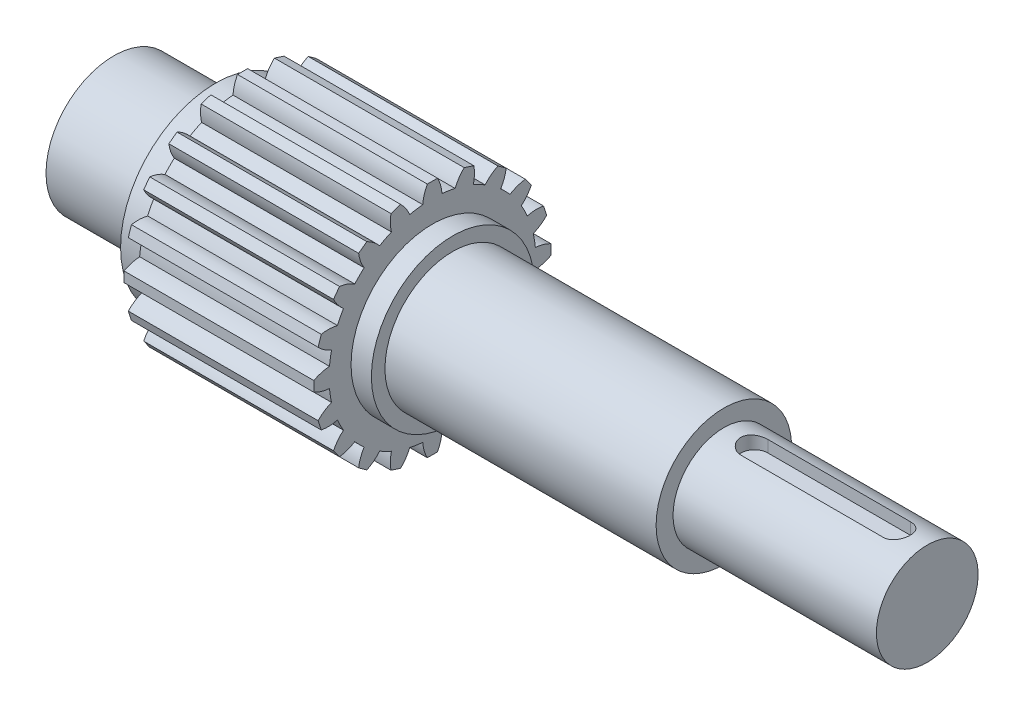
from build123d import *

# Parameters (mm, degrees)
CUT_EXTRUDE_1_DEPTH      = 4
SKETCH_3_W               = 56
SKETCH_3_H               = 6.5
EXTRUDE_1_DEPTH          = 56
PATTERN_CIRCULAR_1_COUNT = 20


with BuildPart() as part:
    # 草图1 → 旋转2 (revolve)
    with BuildSketch(Plane.XY, mode=Mode.PRIVATE) as revolve_2_sk:
        Polygon((-56.927945362, 0), (183.072054638, 0), (183.072054638, 15), (123.072054638, 15), (123.072054638, 20), (43.072054638, 20), (43.072054638, 24), (-18.927945362, 24), (-18.927945362, 28), (-26.927945362, 28), (-26.927945362, 20), (-56.927945362, 20), align=None)
    revolve(revolve_2_sk.sketch.rotate(Axis((-87.906104207, 0, 0), (1, 0, 0)), 90), axis=Axis((-87.906104207, 0, 0), (1, 0, 0)))

    # 草图2 → 切除-拉伸1 (cut)
    with BuildSketch(Plane(origin=(0, 15, 0), x_dir=(-1, 0, 0), z_dir=(0, 1, 0))):
        with BuildLine():
            Line((-174.072054638, -4), (-132.072054638, -4))
            ThreePointArc((-132.072054638, -4), (-128.072054638, 0), (-132.072054638, 4))
            Line((-132.072054638, 4), (-174.072054638, 4))
            ThreePointArc((-174.072054638, 4), (-178.072054638, 0), (-174.072054638, -4))
        make_face()
    extrude(amount=-CUT_EXTRUDE_1_DEPTH, mode=Mode.SUBTRACT)

    # 草图3 → 旋转4 (revolve)
    with BuildSketch(Plane.XY, mode=Mode.PRIVATE) as revolve_4_sk:
        with Locations((9.072054638, 27.25)):
            Rectangle(SKETCH_3_W, SKETCH_3_H)
    revolve(revolve_4_sk.sketch.rotate(Axis((-56.927945362, 0, 0), (1, 0, 0)), 90), axis=Axis((-56.927945362, 0, 0), (1, 0, 0)))

    # 草图5 → 凸台-拉伸1 (add)
    with BuildSketch(Plane(origin=(37.072054638, 0, 0), x_dir=(0, 0, -1), z_dir=(1, 0, 0))):
        with BuildLine():
            Line((-2.63562284, 27.368933751), (2.63562284, 27.368933751))
            ThreePointArc((2.63562284, 27.368933751), (2.733180603, 31.267824503), (1.5, 34.96784237))
            Line((1.5, 34.96784237), (-1.5, 34.96784237))
            ThreePointArc((-1.5, 34.96784237), (-2.733180603, 31.267824503), (-2.63562284, 27.368933751))
        make_face()
    extrude_1 = extrude(amount=-EXTRUDE_1_DEPTH)

    # 阵列(圆周)1: 凸台-拉伸1 ×20 about axis
    pattern_circular_1_axis = Axis((0, 0, 0), (1, 0, 0))
    for i in range(1, PATTERN_CIRCULAR_1_COUNT):
        add(extrude_1.rotate(pattern_circular_1_axis, i * 360 / PATTERN_CIRCULAR_1_COUNT))


solid = part.part
